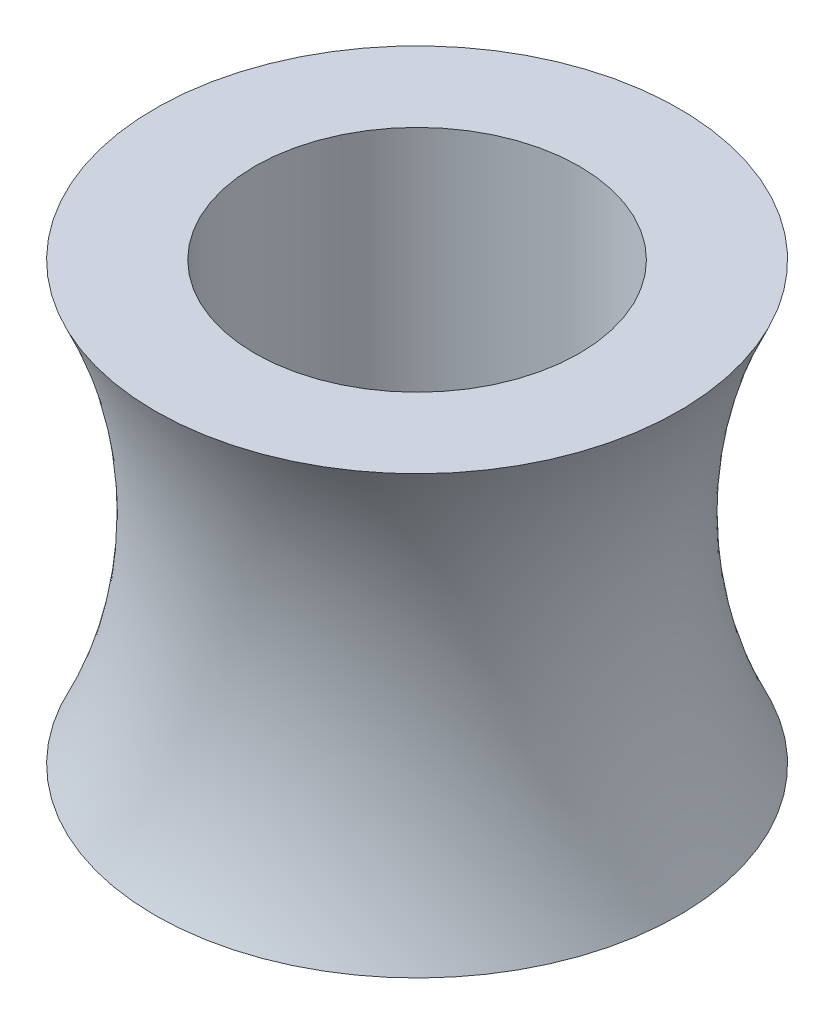
from build123d import *

# Parameters (mm, degrees)
SKETCH1_R           = 8.5
SKETCH1_R_2         = 6.5
BOSS_EXTRUDE1_DEPTH = 17.5


with BuildPart() as part:
    # Sketch1 → Boss-Extrude1 (new body)
    with BuildSketch(Plane(origin=(0, 0, 0), x_dir=(1, 0, 0), z_dir=(0, 1, 0))):
        with Locations(Location((0, 0, 0), (0, 0, 270))):
            Circle(SKETCH1_R)
        with Locations(Location((0, 0, 0), (0, 0, 270))):
            Circle(SKETCH1_R_2, mode=Mode.SUBTRACT)
    extrude(amount=BOSS_EXTRUDE1_DEPTH)

    # Sketch2 → Revolve1 (revolve)
    with BuildSketch(Plane.XY):
        with BuildLine():
            Line((6.5, 17.5), (6.5, 0))
            Line((6.5, 0), (10.5, 0))
            ThreePointArc((10.5, 0), (8.5, 8.75), (10.5, 17.5))
            Line((10.5, 17.5), (6.5, 17.5))
        make_face()
    revolve(axis=Axis((0, 65.415, 0), (0, -1, 0)))


solid = part.part
